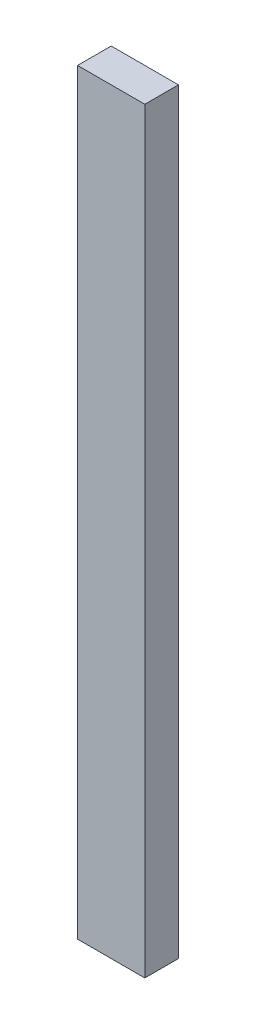
from build123d import *

# Parameters (mm, degrees)
SKETCH_1_W      = 40
SKETCH_1_H      = 20
EXTRUDE_1_DEPTH = 450


with BuildPart() as part:
    # Эскиз1 → Бобышка-Вытянуть1 (new body)
    with BuildSketch(Plane(origin=(0, 0, 0), x_dir=(1, 0, 0), z_dir=(0, 1, 0))):
        with Locations((20, 10)):
            Rectangle(SKETCH_1_W, SKETCH_1_H)
    extrude(amount=EXTRUDE_1_DEPTH)


solid = part.part
